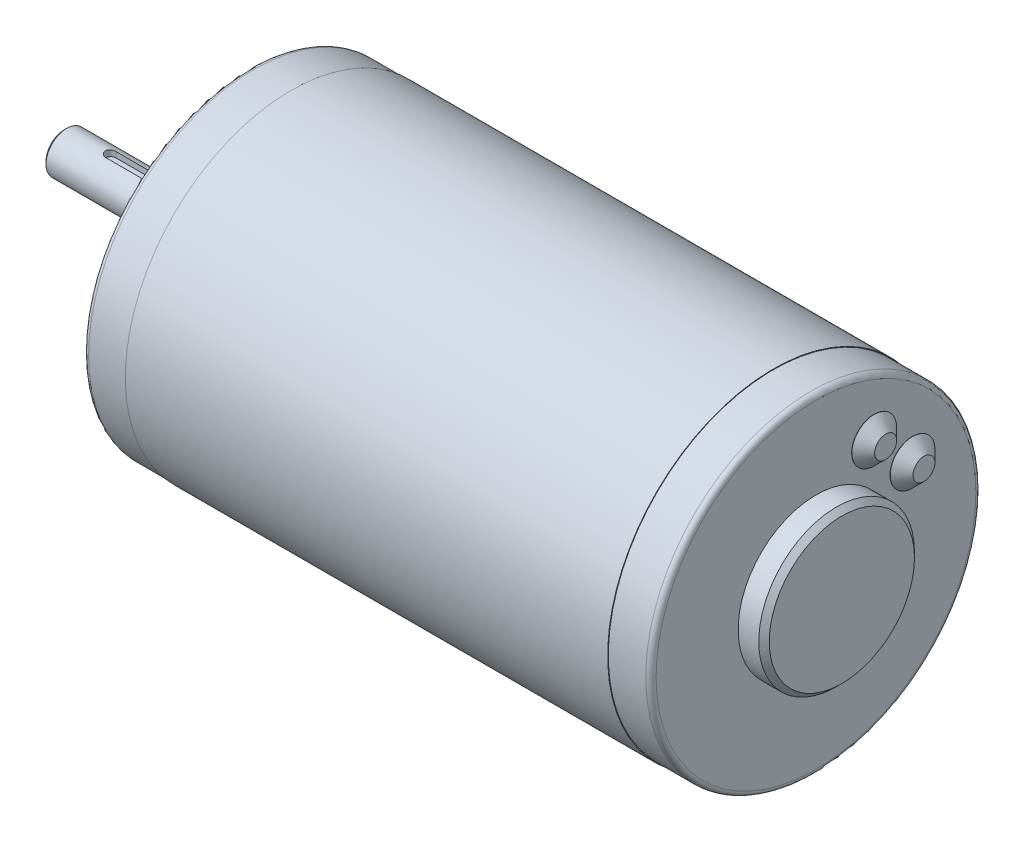
from build123d import *

# Parameters (mm, degrees)
SKETCH1_W                  = 93.1408
SKETCH1_H                  = 32.004
SKETCH2_R                  = 31.877
BOSS_EXTRUDE1_DEPTH        = 8.2296
SKETCH3_R                  = 15.0368
BOSS_EXTRUDE2_DEPTH        = 3.984
SKETCH4_R                  = 15.0368
BOSS_EXTRUDE3_DEPTH        = 1.016
BOSS_EXTRUDE3_TAPER        = 45
BOSS_EXTRUDE4_START        = 8.2296
SKETCH5_R                  = 31.877
BOSS_EXTRUDE4_DEPTH        = 8.2296
SKETCH6_R                  = 9.525
BOSS_EXTRUDE5_DEPTH        = 3.999992
SKETCH7_R                  = 4
BOSS_EXTRUDE6_DEPTH        = 31.6
CUT_EXTRUDE1_REACH         = 125.971
CUT_EXTRUDE1_END_RADIUS    = 4
M3_5_CLEARANCE_HOLE1_D     = 4.0386
M3_5_CLEARANCE_HOLE1_DEPTH = 13.6144
M3_5_CLEARANCE_HOLE1_TIP   = 1.213317848
CHAMFER1_SIZE              = 1.016
CHAMFER2_SIZE              = 0.5
FILLET1_R                  = 1


with BuildPart() as part:
    # Sketch1 → Revolve1 (revolve)
    with BuildSketch(Plane.XY, mode=Mode.PRIVATE) as revolve1_sk:
        with Locations((54.8, 16.002)):
            Rectangle(SKETCH1_W, SKETCH1_H)
    revolve(revolve1_sk.sketch.rotate(Axis((8.2296, 0, 0), (1, 0, 0)), 270), axis=Axis((8.2296, 0, 0), (1, 0, 0)))

    # Sketch2 → Boss-Extrude1 (add)
    with BuildSketch(Plane(origin=(101.3704, 0, 0), x_dir=(0, 0, -1), z_dir=(1, 0, 0))):
        Circle(SKETCH2_R)
    extrude(amount=BOSS_EXTRUDE1_DEPTH)

    # Sketch3 → Boss-Extrude2 (add)
    with BuildSketch(Plane(origin=(109.6, 0, 0), x_dir=(0, 0, -1), z_dir=(1, 0, 0))):
        Circle(SKETCH3_R)
    extrude(amount=BOSS_EXTRUDE2_DEPTH)

    # Sketch4 → Boss-Extrude3 (add)
    with BuildSketch(Plane(origin=(113.584, 0, 0), x_dir=(0, 0, -1), z_dir=(1, 0, 0))):
        Circle(SKETCH4_R)
    extrude(amount=BOSS_EXTRUDE3_DEPTH, taper=BOSS_EXTRUDE3_TAPER)

    # Sketch5 → Boss-Extrude4 (add)
    with BuildSketch(Plane.ZY.offset(-8.2296).offset(BOSS_EXTRUDE4_START)):
        with Locations(Location((0, 0, 0), (0, 0, 180))):
            Circle(SKETCH5_R)
    extrude(amount=-BOSS_EXTRUDE4_DEPTH)

    # Sketch6 → Boss-Extrude5 (add)
    with BuildSketch(Plane.ZY):
        Circle(SKETCH6_R)
    extrude(amount=BOSS_EXTRUDE5_DEPTH)

    # Sketch7 → Boss-Extrude6 (add)
    with BuildSketch(Plane.ZY.offset(3.999992)):
        Circle(SKETCH7_R)
    extrude(amount=BOSS_EXTRUDE6_DEPTH)

    # Cut-Extrude1: up to this cylinder (the profile starts inside it)
    cut_extrude1_end = Plane(origin=(-16.85, 0, 0), z_dir=(1, 0, 0)) * Cylinder(CUT_EXTRUDE1_END_RADIUS, 260.942, mode=Mode.PRIVATE)
    # Sketch8 → Cut-Extrude1 (cut, up to the surface)
    with BuildSketch(Plane.XZ.offset(-2.8), mode=Mode.PRIVATE) as cut_extrude1_sk1:
        with BuildLine():
            Line((-7.1, 1), (-26.6, 1))
            ThreePointArc((-26.6, 1), (-27.6, 0), (-26.6, -1))
            Line((-26.6, -1), (-7.1, -1))
            ThreePointArc((-7.1, -1), (-6.1, 0), (-7.1, 1))
        make_face()
    cut_extrude1_tool1 = extrude(cut_extrude1_sk1.sketch, amount=-CUT_EXTRUDE1_REACH, mode=Mode.PRIVATE) & cut_extrude1_end
    add(cut_extrude1_tool1.solids().sort_by_distance((-16.85, 2.8, 0))[0], mode=Mode.SUBTRACT)

    # Sketch9 → Revolve2 (revolve)
    with BuildSketch(Plane.XY.offset(-18.607090683), mode=Mode.PRIVATE) as revolve2_sk:
        Polygon((109.6, 15.525359639), (109.6, 11.207359639), (111.8479, 11.207359639), (111.8479, 13.325359639), (109.6479, 15.525359639), align=None)
    revolve(revolve2_sk.sketch.rotate(Axis((109.6, 11.207359639, -18.607090683), (1, 0, 0)), 270), axis=Axis((109.6, 11.207359639, -18.607090683), (1, 0, 0)))

    # Sketch10 → Revolve3 (revolve)
    with BuildSketch(Plane.XY.offset(-11.207359639), mode=Mode.PRIVATE) as revolve3_sk:
        Polygon((109.6, 22.925090683), (109.6, 18.607090683), (111.8479, 18.607090683), (111.8479, 20.725090683), (109.6479, 22.925090683), align=None)
    revolve(revolve3_sk.sketch.rotate(Axis((109.6, 18.607090683, -11.207359639), (1, 0, 0)), 270), axis=Axis((109.6, 18.607090683, -11.207359639), (1, 0, 0)))

    # M3.5 Clearance Hole1
    with Locations(Plane.ZY):
        with Locations((0, 25.4), (0, -25.4)):
            Hole(M3_5_CLEARANCE_HOLE1_D / 2, depth=M3_5_CLEARANCE_HOLE1_DEPTH)
            with Locations((0, 0, -(M3_5_CLEARANCE_HOLE1_DEPTH + M3_5_CLEARANCE_HOLE1_TIP / 2))):  # 118° drill point
                Cone(0, M3_5_CLEARANCE_HOLE1_D / 2, M3_5_CLEARANCE_HOLE1_TIP, mode=Mode.SUBTRACT)

    # Chamfer1
    chamfer1_edges = [part.edges().sort_by_distance(p)[0] for p in [
        (-3.999992, 0, -9.525),
    ]]
    chamfer(chamfer1_edges, length=CHAMFER1_SIZE)

    # Chamfer2
    chamfer2_edges = [part.edges().sort_by_distance(p)[0] for p in [
        (-35.599992, 0, -4),
    ]]
    chamfer(chamfer2_edges, length=CHAMFER2_SIZE)

    # Fillet1
    fillet1_edges = [part.edges().sort_by_distance(p)[0] for p in [
        (0, 0, 31.877),
        (109.6, 0, 31.877),
    ]]
    fillet(fillet1_edges, radius=FILLET1_R)


solid = part.part
